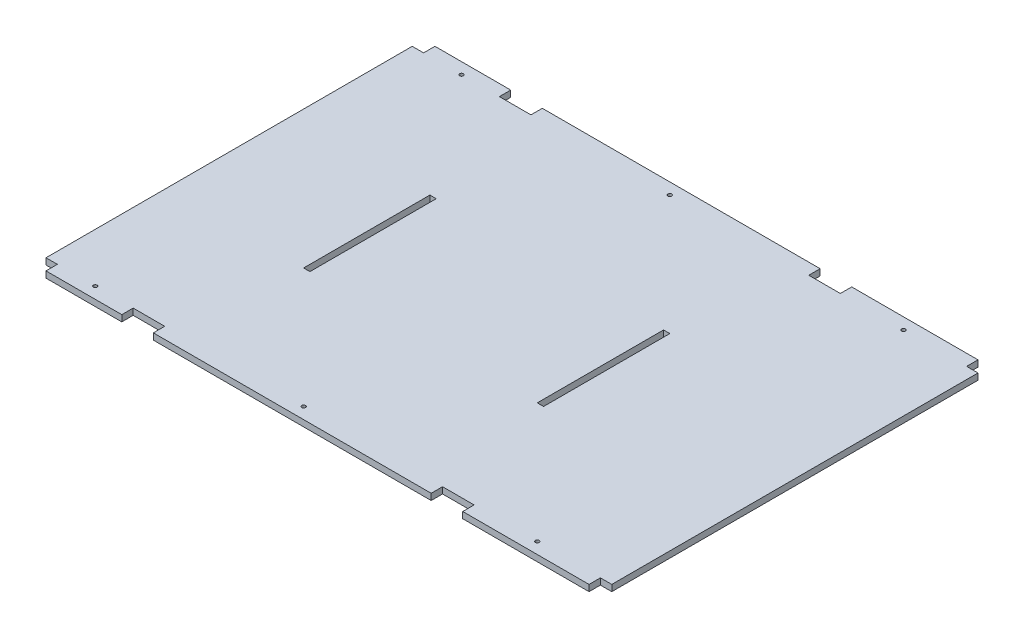
from build123d import *

# Parameters (mm, degrees)
SKIZZE1_W                       = 450
SKIZZE1_H                       = 310
AUFSATZ_LINEAR_AUSTRAGEN1_DEPTH = 5
SKIZZE2_W                       = 10
SKIZZE2_H                       = 10
SKIZZE2_W_2                     = 25
SCHNITT_LINEAR_AUSTRAGEN1_DEPTH = 547.465918425
SKIZZE3_W                       = 5
SKIZZE3_H                       = 100
SCHNITT_LINEAR_AUSTRAGEN2_DEPTH = 547.465918425
SKIZZE4_R                       = 1.5
SCHNITT_LINEAR_AUSTRAGEN3_DEPTH = 547.465918425
SKIZZE5_W                       = 2
SKIZZE5_H                       = 290
SKIZZE5_W_2                     = 60
SKIZZE5_H_2                     = 2
SKIZZE5_W_3                     = 220
SKIZZE5_W_4                     = 100
SCHNITT_LINEAR_AUSTRAGEN4_DEPTH = 547.465918425


with BuildPart() as part:
    # Skizze1 → Aufsatz-Linear austragen1 (new body)
    with BuildSketch(Plane(origin=(0, 0, 0), x_dir=(1, 0, 0), z_dir=(0, 1, 0))):
        with Locations((225, -155)):
            Rectangle(SKIZZE1_W, SKIZZE1_H)
    extrude(amount=AUFSATZ_LINEAR_AUSTRAGEN1_DEPTH)

    # Skizze2 → Schnitt-Linear austragen1 (cut, through all)
    with BuildSketch(Plane(origin=(0, 5, 0), x_dir=(1, 0, 0), z_dir=(0, 1, 0))):
        with Locations((5, -5)):
            Rectangle(SKIZZE2_W, SKIZZE2_H)
        with Locations((445, -305)):
            Rectangle(SKIZZE2_W, SKIZZE2_H)
        with Locations((445, -5)):
            Rectangle(SKIZZE2_W, SKIZZE2_H)
        with Locations((5, -305)):
            Rectangle(SKIZZE2_W, SKIZZE2_H)
        with Locations((82.5, -5)):
            Rectangle(SKIZZE2_W_2, SKIZZE2_H)
        with Locations((327.5, -5)):
            Rectangle(SKIZZE2_W_2, SKIZZE2_H)
        with Locations((327.5, -305)):
            Rectangle(SKIZZE2_W_2, SKIZZE2_H)
        with Locations((82.5, -305)):
            Rectangle(SKIZZE2_W_2, SKIZZE2_H)
    extrude(amount=-SCHNITT_LINEAR_AUSTRAGEN1_DEPTH, mode=Mode.SUBTRACT)

    # Skizze3 → Schnitt-Linear austragen2 (cut, through all)
    with BuildSketch(Plane(origin=(0, 5, 0), x_dir=(1, 0, 0), z_dir=(0, 1, 0))):
        with Locations((112.5, -155)):
            Rectangle(SKIZZE3_W, SKIZZE3_H)
        with Locations((297.5, -155)):
            Rectangle(SKIZZE3_W, SKIZZE3_H)
    extrude(amount=-SCHNITT_LINEAR_AUSTRAGEN2_DEPTH, mode=Mode.SUBTRACT)

    # Skizze4 → Schnitt-Linear austragen3 (cut, through all)
    with BuildSketch(Plane(origin=(0, 5, 0), x_dir=(1, 0, 0), z_dir=(0, 1, 0))):
        with Locations(Location((40, -10, 0), (0, 0, 270))):
            Circle(SKIZZE4_R)
        with Locations(Location((205, -10, 0), (0, 0, 270))):
            Circle(SKIZZE4_R)
        with Locations(Location((390, -10, 0), (0, 0, 270))):
            Circle(SKIZZE4_R)
        with Locations(Location((40, -300, 0), (0, 0, 270))):
            Circle(SKIZZE4_R)
        with Locations(Location((205, -300, 0), (0, 0, 270))):
            Circle(SKIZZE4_R)
        with Locations(Location((390, -300, 0), (0, 0, 270))):
            Circle(SKIZZE4_R)
    extrude(amount=-SCHNITT_LINEAR_AUSTRAGEN3_DEPTH, mode=Mode.SUBTRACT)

    # Skizze5 → Schnitt-Linear austragen4 (cut, through all)
    with BuildSketch(Plane(origin=(0, 5, 0), x_dir=(1, 0, 0), z_dir=(0, 1, 0))):
        with Locations((0, -155)):
            Rectangle(SKIZZE5_W, SKIZZE5_H)
        with Locations((40, 0)):
            Rectangle(SKIZZE5_W_2, SKIZZE5_H_2)
        with Locations((205, 0)):
            Rectangle(SKIZZE5_W_3, SKIZZE5_H_2)
        with Locations((390, 0)):
            Rectangle(SKIZZE5_W_4, SKIZZE5_H_2)
        with Locations((450, -155)):
            Rectangle(SKIZZE5_W, SKIZZE5_H)
        with Locations((390, -310)):
            Rectangle(SKIZZE5_W_4, SKIZZE5_H_2)
        with Locations((205, -310)):
            Rectangle(SKIZZE5_W_3, SKIZZE5_H_2)
        with Locations((40, -310)):
            Rectangle(SKIZZE5_W_2, SKIZZE5_H_2)
    extrude(amount=-SCHNITT_LINEAR_AUSTRAGEN4_DEPTH, mode=Mode.SUBTRACT)


solid = part.part
